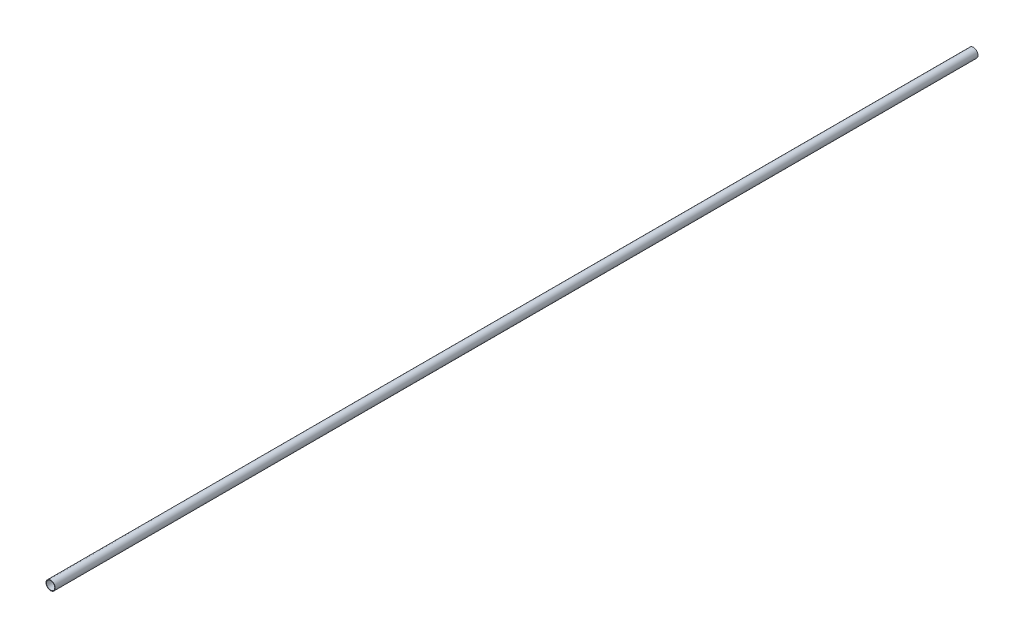
from build123d import *

# Parameters (mm, degrees)
SKETCH2_R           = 5
BOSS_EXTRUDE1_DEPTH = 1000
SKETCH3_R           = 4.5
CUT_EXTRUDE1_DEPTH  = 1001.024999688


with BuildPart() as part:
    # Sketch2 → Boss-Extrude1 (new body)
    with BuildSketch(Plane.XY):
        Circle(SKETCH2_R)
    extrude(amount=BOSS_EXTRUDE1_DEPTH)

    # Sketch3 → Cut-Extrude1 (cut, through all)
    with BuildSketch(Plane.XY.offset(1000)):
        Circle(SKETCH3_R)
    extrude(amount=-CUT_EXTRUDE1_DEPTH, mode=Mode.SUBTRACT)


solid = part.part
